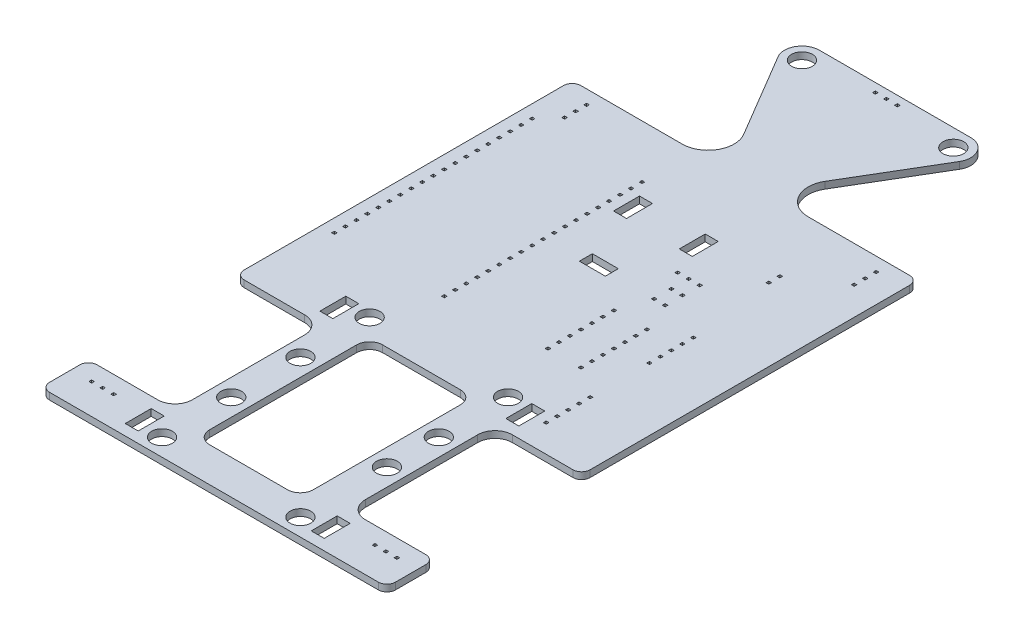
from build123d import *
from OCP.BRepFilletAPI import BRepFilletAPI_MakeFillet

# Parameters (mm, degrees)
SKETCH2_R           = 2.4
BOSS_EXTRUDE1_DEPTH = 1.57
FILLET1_R1          = 4
FILLET1_R2          = 6
FILLET2_R           = 2
SKETCH3_W           = 3
SKETCH3_H           = 6
SKETCH3_W_2         = 6
SKETCH3_H_2         = 3
CUT_EXTRUDE1_DEPTH  = 10
SKETCH4_W           = 0.64
SKETCH4_H           = 0.64
CUT_EXTRUDE2_DEPTH  = 10


with BuildPart() as part:
    # Sketch2 → Boss-Extrude1 (new body)
    with BuildSketch(Plane(origin=(0, 0, 0), x_dir=(1, 0, 0), z_dir=(0, 1, 0))):
        with BuildLine():
            Line((70.915716682, -126.509753408), (70.915716682, -48.669731747))
            Line((70.915716682, -48.669731747), (34.950716682, -48.669731747))
            Line((34.950716682, -48.669731747), (51.886612754, -20.102447618))
            ThreePointArc((51.886612754, -20.102447618), (51.921713055, -16.04745162), (48.415716682, -14.009753408))
            Line((48.415716682, -14.009753408), (13.415716682, -14.009753408))
            ThreePointArc((13.415716682, -14.009753408), (9.909720309, -16.04745162), (9.944820611, -20.102447618))
            Line((9.944820611, -20.102447618), (26.880716682, -48.669731747))
            Line((26.880716682, -48.669731747), (-9.084283318, -48.669731747))
            Line((-9.084283318, -48.669731747), (-9.084283318, -126.509753408))
            Line((-9.084283318, -126.509753408), (10.915716682, -126.509753408))
            Line((10.915716682, -126.509753408), (10.915716682, -160.509753408))
            Line((10.915716682, -160.509753408), (-9.084283318, -160.509753408))
            Line((-9.084283318, -160.509753408), (-9.084283318, -171.509753408))
            Line((-9.084283318, -171.509753408), (70.915716682, -171.509753408))
            Line((70.915716682, -171.509753408), (70.915716682, -160.509753408))
            Line((70.915716682, -160.509753408), (50.915716682, -160.509753408))
            Line((50.915716682, -160.509753408), (50.915716682, -126.509753408))
            Line((50.915716682, -126.509753408), (70.915716682, -126.509753408))
        make_face()
        with BuildLine():
            Line((42.915716682, -126.509753408), (42.915716682, -160.509753408))
            ThreePointArc((42.915716682, -160.509753408), (42.037037026, -162.631073752), (39.915716682, -163.509753408))
            Line((39.915716682, -163.509753408), (21.915716682, -163.509753408))
            ThreePointArc((21.915716682, -163.509753408), (19.794396339, -162.631073752), (18.915716682, -160.509753408))
            Line((18.915716682, -160.509753408), (18.915716682, -126.509753408))
            ThreePointArc((18.915716682, -126.509753408), (19.794396339, -124.388433064), (21.915716682, -123.509753408))
            Line((21.915716682, -123.509753408), (39.915716682, -123.509753408))
            ThreePointArc((39.915716682, -123.509753408), (42.037037026, -124.388433064), (42.915716682, -126.509753408))
        make_face(mode=Mode.SUBTRACT)
        with Locations((46.915716682, -135.509753408)):
            Circle(SKETCH2_R, mode=Mode.SUBTRACT)
        with Locations((46.915716682, -119.509753408)):
            Circle(SKETCH2_R, mode=Mode.SUBTRACT)
        with Locations((14.915716682, -119.509753408)):
            Circle(SKETCH2_R, mode=Mode.SUBTRACT)
        with Locations((14.915716682, -135.509753408)):
            Circle(SKETCH2_R, mode=Mode.SUBTRACT)
        with Locations((46.915716682, -147.509753408)):
            Circle(SKETCH2_R, mode=Mode.SUBTRACT)
        with Locations((14.915716682, -151.509753408)):
            Circle(SKETCH2_R, mode=Mode.SUBTRACT)
        with Locations((48.415716682, -18.044753408)):
            Circle(SKETCH2_R, mode=Mode.SUBTRACT)
        with Locations((13.415716682, -18.044753408)):
            Circle(SKETCH2_R, mode=Mode.SUBTRACT)
        with Locations((14.915716682, -167.509753408)):
            Circle(SKETCH2_R, mode=Mode.SUBTRACT)
        with Locations((46.915716682, -167.509753408)):
            Circle(SKETCH2_R, mode=Mode.SUBTRACT)
    extrude(amount=BOSS_EXTRUDE1_DEPTH)

    # Fillet1: one fillet with a radius per group of edges: ONE call of the kernel's fillet builder (fillet() takes one radius for all edges)
    fillet1_edges_1 = [part.edges().sort_by_distance(p)[0] for p in [
        (50.915716682, 0.785, 126.509753408),
        (50.915716682, 0.785, 160.509753408),
        (10.915716682, 0.785, 126.509753408),
        (10.915716682, 0.785, 160.509753408),
    ]]
    fillet1_edges_2 = [part.edges().sort_by_distance(p)[0] for p in [
        (26.880716682, 0.785, 48.669731747),
        (34.950716682, 0.785, 48.669731747),
    ]]
    fillet1 = BRepFilletAPI_MakeFillet(part.part.solid().wrapped)
    for e in fillet1_edges_1:
        fillet1.Add(FILLET1_R1, e.wrapped)
    for e in fillet1_edges_2:
        fillet1.Add(FILLET1_R2, e.wrapped)
    add(Compound.cast(fillet1.Shape()), mode=Mode.REPLACE)

    # Fillet2
    fillet2_edges = [part.edges().sort_by_distance(p)[0] for p in [
        (-9.084283318, 0.785, 171.509753408),
        (-9.084283318, 0.785, 160.509753408),
        (-9.084283318, 0.785, 126.509753408),
        (-9.084283318, 0.785, 48.669731747),
        (70.915716682, 0.785, 48.669731747),
        (70.915716682, 0.785, 171.509753408),
        (70.915716682, 0.785, 160.509753408),
        (70.915716682, 0.785, 126.509753408),
    ]]
    fillet(fillet2_edges, radius=FILLET2_R)

    # Sketch3 → Cut-Extrude1 (cut)
    with BuildSketch(Plane(origin=(0, 1.57, 0), x_dir=(1, 0, 0), z_dir=(0, 1, 0))):
        with Locations((9.415716682, -166.009753408)):
            Rectangle(SKETCH3_W, SKETCH3_H)
        with Locations((52.415716682, -166.009753408)):
            Rectangle(SKETCH3_W, SKETCH3_H)
        with Locations((52.415716682, -121.009753408)):
            Rectangle(SKETCH3_W, SKETCH3_H)
        with Locations((9.415716682, -121.009753408)):
            Rectangle(SKETCH3_W, SKETCH3_H)
        with Locations((23.315716682, -67.009753408)):
            Rectangle(SKETCH3_W, SKETCH3_H)
        with Locations((38.515716682, -67.009753408)):
            Rectangle(SKETCH3_W, SKETCH3_H)
        with Locations((30.915716682, -82.509753408)):
            Rectangle(SKETCH3_W_2, SKETCH3_H_2)
    extrude(amount=-CUT_EXTRUDE1_DEPTH, mode=Mode.SUBTRACT)

    # Sketch4 → Cut-Extrude2 (cut)
    with BuildSketch(Plane.XZ):
        with Locations((-2.559283318, 51.874731747)):
            Rectangle(SKETCH4_W, SKETCH4_H)
        with Locations((-2.559283318, 54.414731747)):
            Rectangle(SKETCH4_W, SKETCH4_H)
        with Locations((-2.559283318, 56.954731747)):
            Rectangle(SKETCH4_W, SKETCH4_H)
        with Locations((-6.089283318, 60.924731747)):
            Rectangle(SKETCH4_W, SKETCH4_H)
        with Locations((-6.089283318, 63.464731747)):
            Rectangle(SKETCH4_W, SKETCH4_H)
        with Locations((-6.089283318, 66.004731747)):
            Rectangle(SKETCH4_W, SKETCH4_H)
        with Locations((-6.089283318, 68.544731747)):
            Rectangle(SKETCH4_W, SKETCH4_H)
        with Locations((-6.089283318, 71.084731747)):
            Rectangle(SKETCH4_W, SKETCH4_H)
        with Locations((-6.089283318, 73.624731747)):
            Rectangle(SKETCH4_W, SKETCH4_H)
        with Locations((-6.089283318, 76.164731747)):
            Rectangle(SKETCH4_W, SKETCH4_H)
        with Locations((-6.089283318, 81.244731747)):
            Rectangle(SKETCH4_W, SKETCH4_H)
        with Locations((-6.089283318, 78.704731747)):
            Rectangle(SKETCH4_W, SKETCH4_H)
        with Locations((-6.089283318, 83.784731747)):
            Rectangle(SKETCH4_W, SKETCH4_H)
        with Locations((-6.089283318, 86.324731747)):
            Rectangle(SKETCH4_W, SKETCH4_H)
        with Locations((-6.089283318, 88.864731747)):
            Rectangle(SKETCH4_W, SKETCH4_H)
        with Locations((-6.089283318, 91.404731747)):
            Rectangle(SKETCH4_W, SKETCH4_H)
        with Locations((-6.089283318, 93.944731747)):
            Rectangle(SKETCH4_W, SKETCH4_H)
        with Locations((-6.089283318, 96.484731747)):
            Rectangle(SKETCH4_W, SKETCH4_H)
        with Locations((-6.089283318, 99.024731747)):
            Rectangle(SKETCH4_W, SKETCH4_H)
        with Locations((-6.089283318, 101.564731747)):
            Rectangle(SKETCH4_W, SKETCH4_H)
        with Locations((-6.089283318, 104.104731747)):
            Rectangle(SKETCH4_W, SKETCH4_H)
        with Locations((-6.089283318, 106.644731747)):
            Rectangle(SKETCH4_W, SKETCH4_H)
        with Locations((19.310716682, 63.464731747)):
            Rectangle(SKETCH4_W, SKETCH4_H)
        with Locations((19.310716682, 60.924731747)):
            Rectangle(SKETCH4_W, SKETCH4_H)
        with Locations((19.310716682, 66.004731747)):
            Rectangle(SKETCH4_W, SKETCH4_H)
        with Locations((19.310716682, 68.544731747)):
            Rectangle(SKETCH4_W, SKETCH4_H)
        with Locations((19.310716682, 71.084731747)):
            Rectangle(SKETCH4_W, SKETCH4_H)
        with Locations((19.310716682, 73.624731747)):
            Rectangle(SKETCH4_W, SKETCH4_H)
        with Locations((19.310716682, 76.164731747)):
            Rectangle(SKETCH4_W, SKETCH4_H)
        with Locations((19.310716682, 78.704731747)):
            Rectangle(SKETCH4_W, SKETCH4_H)
        with Locations((19.310716682, 81.244731747)):
            Rectangle(SKETCH4_W, SKETCH4_H)
        with Locations((19.310716682, 83.784731747)):
            Rectangle(SKETCH4_W, SKETCH4_H)
        with Locations((19.310716682, 86.324731747)):
            Rectangle(SKETCH4_W, SKETCH4_H)
        with Locations((19.310716682, 88.864731747)):
            Rectangle(SKETCH4_W, SKETCH4_H)
        with Locations((19.310716682, 91.404731747)):
            Rectangle(SKETCH4_W, SKETCH4_H)
        with Locations((19.310716682, 93.944731747)):
            Rectangle(SKETCH4_W, SKETCH4_H)
        with Locations((19.310716682, 96.484731747)):
            Rectangle(SKETCH4_W, SKETCH4_H)
        with Locations((19.310716682, 99.024731747)):
            Rectangle(SKETCH4_W, SKETCH4_H)
        with Locations((19.310716682, 101.564731747)):
            Rectangle(SKETCH4_W, SKETCH4_H)
        with Locations((19.310716682, 104.104731747)):
            Rectangle(SKETCH4_W, SKETCH4_H)
        with Locations((19.310716682, 106.644731747)):
            Rectangle(SKETCH4_W, SKETCH4_H)
        with Locations((41.770716682, 92.414731747)):
            Rectangle(SKETCH4_W, SKETCH4_H)
        with Locations((41.770716682, 89.874731747)):
            Rectangle(SKETCH4_W, SKETCH4_H)
        with Locations((41.770716682, 94.954731747)):
            Rectangle(SKETCH4_W, SKETCH4_H)
        with Locations((41.770716682, 97.494731747)):
            Rectangle(SKETCH4_W, SKETCH4_H)
        with Locations((41.770716682, 100.034731747)):
            Rectangle(SKETCH4_W, SKETCH4_H)
        with Locations((41.770716682, 102.574731747)):
            Rectangle(SKETCH4_W, SKETCH4_H)
        with Locations((41.770716682, 105.114731747)):
            Rectangle(SKETCH4_W, SKETCH4_H)
        with Locations((49.390716682, 92.414731747)):
            Rectangle(SKETCH4_W, SKETCH4_H)
        with Locations((49.390716682, 89.874731747)):
            Rectangle(SKETCH4_W, SKETCH4_H)
        with Locations((49.390716682, 94.954731747)):
            Rectangle(SKETCH4_W, SKETCH4_H)
        with Locations((49.390716682, 97.494731747)):
            Rectangle(SKETCH4_W, SKETCH4_H)
        with Locations((49.390716682, 100.034731747)):
            Rectangle(SKETCH4_W, SKETCH4_H)
        with Locations((49.390716682, 102.574731747)):
            Rectangle(SKETCH4_W, SKETCH4_H)
        with Locations((49.390716682, 105.114731747)):
            Rectangle(SKETCH4_W, SKETCH4_H)
        with Locations((56.390716682, 112.539753408)):
            Rectangle(SKETCH4_W, SKETCH4_H)
        with Locations((56.390716682, 109.999753408)):
            Rectangle(SKETCH4_W, SKETCH4_H)
        with Locations((56.390716682, 115.079753408)):
            Rectangle(SKETCH4_W, SKETCH4_H)
        with Locations((56.390716682, 117.619753408)):
            Rectangle(SKETCH4_W, SKETCH4_H)
        with Locations((56.390716682, 120.159753408)):
            Rectangle(SKETCH4_W, SKETCH4_H)
        with Locations((56.390716682, 88.679753408)):
            Rectangle(SKETCH4_W, SKETCH4_H)
        with Locations((56.390716682, 86.139753408)):
            Rectangle(SKETCH4_W, SKETCH4_H)
        with Locations((56.390716682, 91.219753408)):
            Rectangle(SKETCH4_W, SKETCH4_H)
        with Locations((56.390716682, 93.759753408)):
            Rectangle(SKETCH4_W, SKETCH4_H)
        with Locations((56.390716682, 96.299753408)):
            Rectangle(SKETCH4_W, SKETCH4_H)
        with Locations((54.115716682, 63.862110013)):
            Rectangle(SKETCH4_W, SKETCH4_H)
        with Locations((54.115716682, 66.402110013)):
            Rectangle(SKETCH4_W, SKETCH4_H)
        with Locations((64.390716682, 51.874731747)):
            Rectangle(SKETCH4_W, SKETCH4_H)
        with Locations((64.390716682, 54.414731747)):
            Rectangle(SKETCH4_W, SKETCH4_H)
        with Locations((44.105716682, 78.919731747)):
            Rectangle(SKETCH4_W, SKETCH4_H)
        with Locations((64.390716682, 56.954731747)):
            Rectangle(SKETCH4_W, SKETCH4_H)
        with Locations((44.105716682, 82.919731747)):
            Rectangle(SKETCH4_W, SKETCH4_H)
        with Locations((46.645716682, 82.919731747)):
            Rectangle(SKETCH4_W, SKETCH4_H)
        with Locations((46.645716682, 78.919731747)):
            Rectangle(SKETCH4_W, SKETCH4_H)
        with Locations((44.105716682, 74.919731747)):
            Rectangle(SKETCH4_W, SKETCH4_H)
        with Locations((46.645716682, 74.919731747)):
            Rectangle(SKETCH4_W, SKETCH4_H)
        with Locations((41.565716682, 74.919731747)):
            Rectangle(SKETCH4_W, SKETCH4_H)
        with Locations((61.130716682, 164.484753408)):
            Rectangle(SKETCH4_W, SKETCH4_H)
        with Locations((63.670716682, 164.484753408)):
            Rectangle(SKETCH4_W, SKETCH4_H)
        with Locations((66.210716682, 164.484753408)):
            Rectangle(SKETCH4_W, SKETCH4_H)
        with Locations((-4.379283318, 164.484753408)):
            Rectangle(SKETCH4_W, SKETCH4_H)
        with Locations((-1.839283318, 164.484753408)):
            Rectangle(SKETCH4_W, SKETCH4_H)
        with Locations((0.700716682, 164.484753408)):
            Rectangle(SKETCH4_W, SKETCH4_H)
        with Locations((33.455716682, 16.034753408)):
            Rectangle(SKETCH4_W, SKETCH4_H)
        with Locations((28.375716682, 16.034753408)):
            Rectangle(SKETCH4_W, SKETCH4_H)
        with Locations((30.915716682, 16.034753408)):
            Rectangle(SKETCH4_W, SKETCH4_H)
    extrude(amount=-CUT_EXTRUDE2_DEPTH, mode=Mode.SUBTRACT)


solid = part.part
